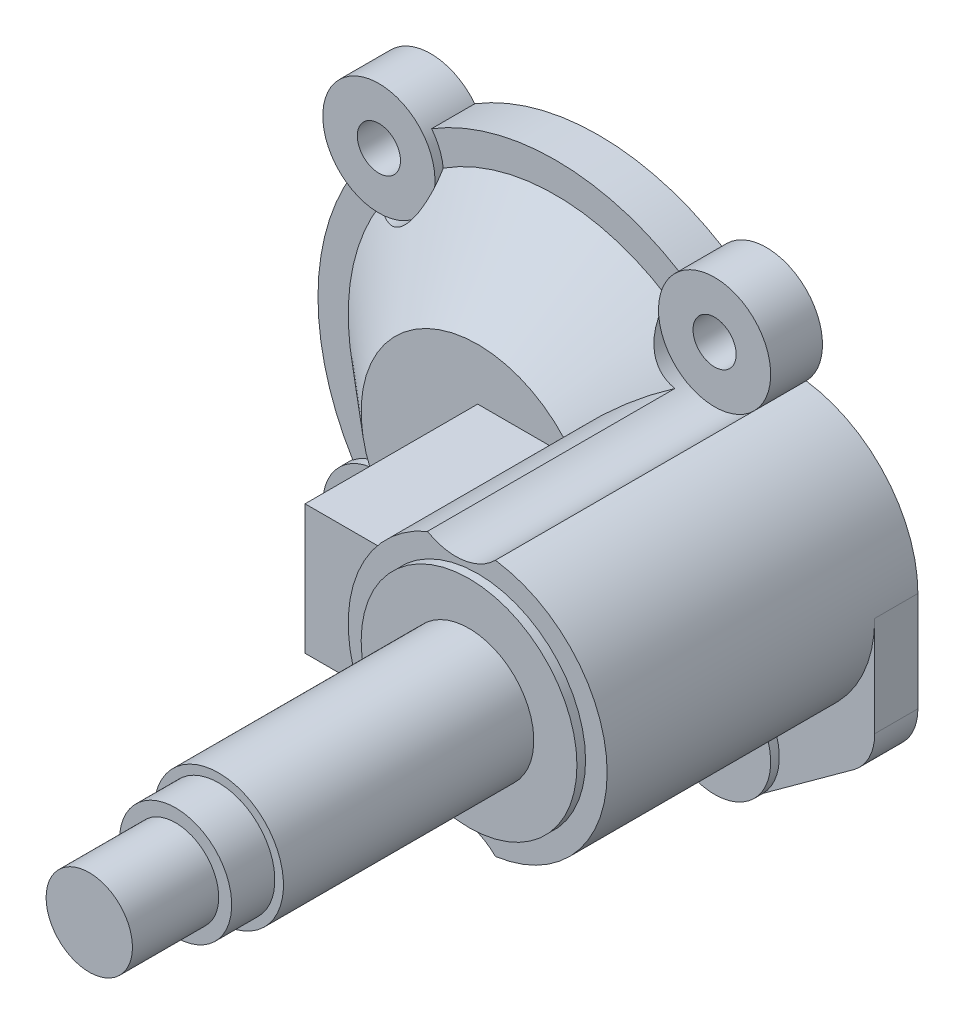
from build123d import *

# Parameters (mm, degrees)
SKETCH1_R           = 2.5
BOSS_EXTRUDE1_DEPTH = 5
BOSS_EXTRUDE2_START = -5
BOSS_EXTRUDE2_DEPTH = 5
SKETCH8_W           = 9.009618943
SKETCH8_H           = 15
BOSS_EXTRUDE3_DEPTH = 20
SKETCH1_3_R         = 6.5
CUT_EXTRUDE1_DEPTH  = 89.888975736
FILLET1_R           = 6
BOSS_EXTRUDE4_START = 1
SKETCH1_4_R         = 6.5
SKETCH1_4_R_2       = 2.5
BOSS_EXTRUDE4_DEPTH = 1


with BuildPart() as part:
    # Sketch1 → Boss-Extrude1 (new body)
    with BuildSketch(Plane(origin=(0, 0, 0), x_dir=(0, 1, 0), z_dir=(0, 0, 1))):
        with BuildLine():
            ThreePointArc((23.466233734, -14.338266086), (27.5, 0), (23.466233734, 14.338266086))
            ThreePointArc((23.466233734, 14.338266086), (24.04163056, 24.04163056), (14.338266086, 23.466233734))
            ThreePointArc((14.338266086, 23.466233734), (0, 27.5), (-14.338266086, 23.466233734))
            ThreePointArc((-14.338266086, 23.466233734), (-24.04163056, 24.04163056), (-23.466233734, 14.338266086))
            ThreePointArc((-23.466233734, 14.338266086), (-27.5, 0), (-23.466233734, -14.338266086))
            ThreePointArc((-23.466233734, -14.338266086), (-24.04163056, -24.04163056), (-14.338266086, -23.466233734))
            ThreePointArc((-14.338266086, -23.466233734), (0, -27.5), (14.338266086, -23.466233734))
            ThreePointArc((14.338266086, -23.466233734), (24.04163056, -24.04163056), (23.466233734, -14.338266086))
        make_face()
        with Locations(Location((-19.445436483, 19.445436483, 0), (0, 0, 270))):
            Circle(SKETCH1_R, mode=Mode.SUBTRACT)
        with Locations(Location((19.445436483, 19.445436483, 0), (0, 0, 270))):
            Circle(SKETCH1_R, mode=Mode.SUBTRACT)
        with Locations(Location((19.445436483, -19.445436483, 0), (0, 0, 270))):
            Circle(SKETCH1_R, mode=Mode.SUBTRACT)
        with Locations(Location((-19.445436483, -19.445436483, 0), (0, 0, 270))):
            Circle(SKETCH1_R, mode=Mode.SUBTRACT)
    extrude(amount=-BOSS_EXTRUDE1_DEPTH)

    # Sketch5 → Revolve1 (revolve)
    with BuildSketch(Plane.YZ, mode=Mode.PRIVATE) as revolve1_sk:
        Polygon((0, 0), (24, 0), (13.5, 9), (0, 9), align=None)
    revolve(revolve1_sk.sketch.rotate(Axis((0, 0, 9), (0, 0, -1)), 180), axis=Axis((0, 0, 9), (0, 0, -1)))

    # Sketch6 → Boss-Extrude2 (add)
    with BuildSketch(Plane.YX.offset(5).offset(BOSS_EXTRUDE2_START)):
        with BuildLine():
            ThreePointArc((0, 37), (-9.854658782, 33.30865599), (-14.859059475, 24.051426706))
            ThreePointArc((-14.859059475, 24.051426706), (-14.589838885, 23.766683059), (-14.338266086, 23.466233734))
            ThreePointArc((-14.338266086, 23.466233734), (-7.447434871, 26.472357542), (0, 27.5))
            Line((0, 27.5), (0, 37))
        make_face()
        with BuildLine():
            ThreePointArc((14.859059475, 24.051426706), (9.854658782, 33.30865599), (0, 37))
            Line((0, 37), (0, 27.5))
            ThreePointArc((0, 27.5), (7.447434871, 26.472357542), (14.338266086, 23.466233734))
            ThreePointArc((14.338266086, 23.466233734), (14.589838885, 23.766683059), (14.859059475, 24.051426706))
        make_face()
        with BuildLine():
            Line((-14.626824069, 37), (-24.04163056, 24.04163056))
            ThreePointArc((-24.04163056, 24.04163056), (-19.452370805, 25.945432784), (-14.859059475, 24.051426706))
            ThreePointArc((-14.859059475, 24.051426706), (-9.854658782, 33.30865599), (0, 37))
            Line((0, 37), (-14.626824069, 37))
        make_face()
        with BuildLine():
            ThreePointArc((-14.338266086, 23.466233734), (-14.589838885, 23.766683059), (-14.859059475, 24.051426706))
            ThreePointArc((-14.859059475, 24.051426706), (-1.028131286, 7.035276613), (15, 22))
            ThreePointArc((15, 22), (14.964723387, 23.028131286), (14.859059475, 24.051426706))
            ThreePointArc((14.859059475, 24.051426706), (14.589838885, 23.766683059), (14.338266086, 23.466233734))
            ThreePointArc((14.338266086, 23.466233734), (7.447434871, 26.472357542), (0, 27.5))
            ThreePointArc((0, 27.5), (-7.447434871, 26.472357542), (-14.338266086, 23.466233734))
        make_face()
    extrude(amount=BOSS_EXTRUDE2_DEPTH)

    # Sketch7 → Revolve2 (revolve)
    with BuildSketch(Plane(origin=(0, 0, 0), x_dir=(-1, 0, 0), z_dir=(0, 1, 0)), mode=Mode.PRIVATE) as revolve2_sk:
        Polygon((-22, 0), (-22, 76), (-27, 76), (-27, 66), (-28.5, 66), (-28.5, 61), (-29.5, 61), (-29.5, 32), (-34.5, 32), (-34.5, 31), (-37, 31), (-37, 0), align=None)
    revolve(revolve2_sk.sketch.rotate(Axis((22, 0, 0), (0, 0, 1)), 180), axis=Axis((22, 0, 0), (0, 0, 1)))

    # Sketch8 → Boss-Extrude3 (add)
    with BuildSketch(Plane.XY.offset(9)):
        with Locations((4.504809472, 0)):
            Rectangle(SKETCH8_W, SKETCH8_H)
    extrude(amount=BOSS_EXTRUDE3_DEPTH)

    # Sketch1<3> → Cut-Extrude1 (cut, through all)
    with BuildSketch(Plane(origin=(0, 0, 0), x_dir=(0, 1, 0), z_dir=(0, 0, 1))):
        with Locations((19.445436483, 19.445436483)):
            Circle(SKETCH1_3_R)
        with Locations((-19.445436483, 19.445436483)):
            Circle(SKETCH1_3_R)
        with Locations((-19.445436483, -19.445436483)):
            Circle(SKETCH1_3_R)
        with Locations((19.445436483, -19.445436483)):
            Circle(SKETCH1_3_R)
    extrude(amount=CUT_EXTRUDE1_DEPTH, mode=Mode.SUBTRACT)

    # Fillet1
    fillet1_edges = [part.edges().sort_by_distance(p)[0] for p in [
        (37, -14.626824069, -2.5),
    ]]
    fillet(fillet1_edges, radius=FILLET1_R)

    # Sketch1<4> → Boss-Extrude4 (add)
    # profile 1 of 4: a face of its own
    with BuildSketch(Plane(origin=(0, 0, 0), x_dir=(0, 1, 0), z_dir=(0, 0, 1)).offset(BOSS_EXTRUDE4_START)):
        with Locations((19.445436483, 19.445436483)):
            Circle(SKETCH1_4_R)
        with Locations(Location((19.445436483, 19.445436483, 0), (0, 0, 270))):
            Circle(SKETCH1_4_R_2, mode=Mode.SUBTRACT)
    # profile 2 of 4: a face of its own
    with BuildSketch(Plane(origin=(0, 0, 0), x_dir=(0, 1, 0), z_dir=(0, 0, 1)).offset(BOSS_EXTRUDE4_START)):
        with Locations((19.445436483, -19.445436483)):
            Circle(SKETCH1_4_R)
        with Locations(Location((19.445436483, -19.445436483, 0), (0, 0, 270))):
            Circle(SKETCH1_4_R_2, mode=Mode.SUBTRACT)
    # profile 3 of 4: a face of its own
    with BuildSketch(Plane(origin=(0, 0, 0), x_dir=(0, 1, 0), z_dir=(0, 0, 1)).offset(BOSS_EXTRUDE4_START)):
        with Locations((-19.445436483, 19.445436483)):
            Circle(SKETCH1_4_R)
        with Locations(Location((-19.445436483, 19.445436483, 0), (0, 0, 270))):
            Circle(SKETCH1_4_R_2, mode=Mode.SUBTRACT)
    # profile 4 of 4: a face of its own
    with BuildSketch(Plane(origin=(0, 0, 0), x_dir=(0, 1, 0), z_dir=(0, 0, 1)).offset(BOSS_EXTRUDE4_START)):
        with Locations((-19.445436483, -19.445436483)):
            Circle(SKETCH1_4_R)
        with Locations(Location((-19.445436483, -19.445436483, 0), (0, 0, 270))):
            Circle(SKETCH1_4_R_2, mode=Mode.SUBTRACT)
    extrude(amount=-BOSS_EXTRUDE4_DEPTH)


solid = part.part
